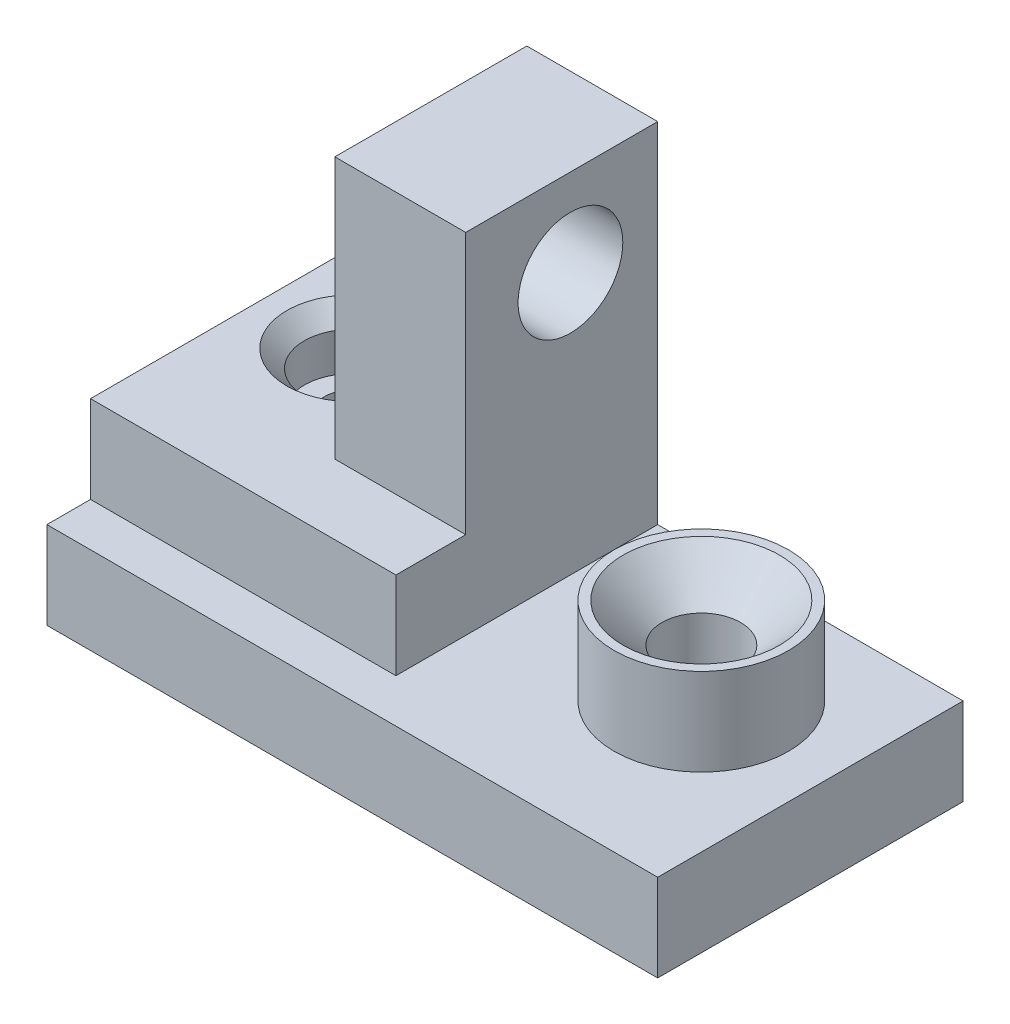
from build123d import *

# Parameters (mm, degrees)
SKETCH1_R                                            = 10
BOSS_EXTRUDE1_DEPTH                                  = 10
SKETCH1_3_R                                          = 10
BOSS_EXTRUDE2_DEPTH                                  = 20
SKETCH1_4_W                                          = 15
SKETCH1_4_H                                          = 22
BOSS_EXTRUDE3_DEPTH                                  = 50
CSK_FOR_M8_HEX_SOCKET_COUNTERSUNK_CAP_SC_D           = 9
CSK_FOR_M8_HEX_SOCKET_COUNTERSUNK_CAP_SC_CSINK_D     = 17.92
CSK_FOR_M8_HEX_SOCKET_COUNTERSUNK_CAP_SC_CSINK_ANGLE = 90
TAP_DRILL_FOR_M8_TAP1_D                              = 12
TAP_DRILL_FOR_M8_TAP1_DEPTH                          = 10
TAP_DRILL_FOR_M8_TAP1_TIP                            = 3.464101615


with BuildPart() as part:
    # Sketch1 → Boss-Extrude1 (new body)
    with BuildSketch(Plane(origin=(0, 0, 0), x_dir=(1, 0, 0), z_dir=(0, 1, 0))):
        Polygon((0, 5), (0, 0), (70, 0), (70, 35), (35, 35), (35, 13), (35, 5), align=None)
        with Locations((55, 20)):
            Circle(SKETCH1_R, mode=Mode.SUBTRACT)
    extrude(amount=BOSS_EXTRUDE1_DEPTH)

    # Sketch1<3> → Boss-Extrude2 (add)
    with BuildSketch(Plane(origin=(0, 0, 0), x_dir=(1, 0, 0), z_dir=(0, 1, 0))):
        Polygon((0, 35), (0, 5), (35, 5), (35, 13), (20, 13), (20, 35), align=None)
        with Locations((55, 20)):
            Circle(SKETCH1_3_R)
    extrude(amount=BOSS_EXTRUDE2_DEPTH)

    # Sketch1<4> → Boss-Extrude3 (add)
    with BuildSketch(Plane(origin=(0, 0, 0), x_dir=(1, 0, 0), z_dir=(0, 1, 0))):
        with Locations((27.5, 24)):
            Rectangle(SKETCH1_4_W, SKETCH1_4_H)
    extrude(amount=BOSS_EXTRUDE3_DEPTH)

    # CSK for M8 Hex Socket Countersunk Cap Screw1 (through all)
    with Locations(Plane(origin=(55, 20, -20), x_dir=(0, 0, 1), z_dir=(0, 1, 0))):
        with Locations((0, 0)):
            CounterSinkHole(CSK_FOR_M8_HEX_SOCKET_COUNTERSUNK_CAP_SC_D / 2, CSK_FOR_M8_HEX_SOCKET_COUNTERSUNK_CAP_SC_CSINK_D / 2, counter_sink_angle=CSK_FOR_M8_HEX_SOCKET_COUNTERSUNK_CAP_SC_CSINK_ANGLE)

    # Sketch5 → CBORE for M6 Hex Socket Head Cap Screw1 (revolve, cut)
    with BuildSketch(Plane(origin=(10, 20, -25), x_dir=(0, 0, 1), z_dir=(1, 0, 0))):
        Polygon((0, 0), (0, 11.922753981), (3.2, 10), (3.2, 6.4), (5.5, 6.4), (5.5, 2), (7.5, 0), align=None)
    revolve(axis=Axis((10, 26.35, -25), (0, -1, 0)), mode=Mode.SUBTRACT)

    # Tap Drill for M8 Tap1
    with Locations(Plane(origin=(35, 40, -25), x_dir=(0, 0, 1), z_dir=(1, 0, 0))):
        with Locations((0, 0)):
            Hole(TAP_DRILL_FOR_M8_TAP1_D / 2, depth=TAP_DRILL_FOR_M8_TAP1_DEPTH)
            with Locations((0, 0, -(TAP_DRILL_FOR_M8_TAP1_DEPTH + TAP_DRILL_FOR_M8_TAP1_TIP / 2))):  # 120° drill point
                Cone(0, TAP_DRILL_FOR_M8_TAP1_D / 2, TAP_DRILL_FOR_M8_TAP1_TIP, mode=Mode.SUBTRACT)


solid = part.part
